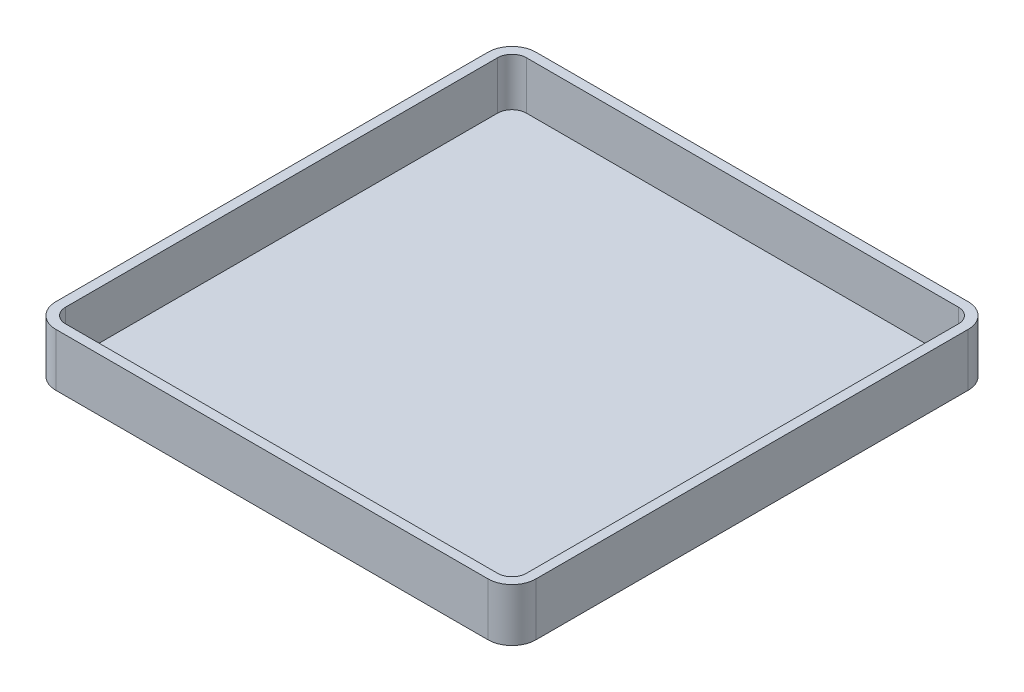
from build123d import *

# Parameters (mm, degrees)
SKETCH1_W           = 100
SKETCH1_H           = 100
SKETCH1_W_2         = 96
SKETCH1_H_2         = 96
EXTRUDE_THIN1_DEPTH = 10
FILLET1_R           = 5
FILLET2_R           = 3
BOSS_EXTRUDE1_DEPTH = 1


with BuildPart() as part:
    # Sketch1 → Extrude-Thin1 (new body)
    with BuildSketch(Plane(origin=(0, 0, 0), x_dir=(1, 0, 0), z_dir=(0, 1, 0))):
        Rectangle(SKETCH1_W, SKETCH1_H)
        Rectangle(SKETCH1_W_2, SKETCH1_H_2, mode=Mode.SUBTRACT)
    extrude(amount=EXTRUDE_THIN1_DEPTH)

    # Fillet1
    fillet1_edges = [part.edges().sort_by_distance(p)[0] for p in [
        (50, 5, 50),
        (-50, 5, 50),
        (-50, 5, -50),
        (50, 5, -50),
    ]]
    fillet(fillet1_edges, radius=FILLET1_R)

    # Fillet2
    fillet2_edges = [part.edges().sort_by_distance(p)[0] for p in [
        (48, 5, 48),
        (48, 5, -48),
        (-48, 5, -48),
        (-48, 5, 48),
    ]]
    fillet(fillet2_edges, radius=FILLET2_R)

    # Sketch2 → Boss-Extrude1 (add)
    with BuildSketch(Plane.XZ):
        with BuildLine():
            Line((45, 50), (-45, 50))
            ThreePointArc((-45, 50), (-48.535533906, 48.535533906), (-50, 45))
            Line((-50, 45), (-50, -45))
            ThreePointArc((-50, -45), (-48.535533906, -48.535533906), (-45, -50))
            Line((-45, -50), (45, -50))
            ThreePointArc((45, -50), (48.535533906, -48.535533906), (50, -45))
            Line((50, -45), (50, 45))
            ThreePointArc((50, 45), (48.535533906, 48.535533906), (45, 50))
        make_face()
    extrude(amount=BOSS_EXTRUDE1_DEPTH)


solid = part.part
